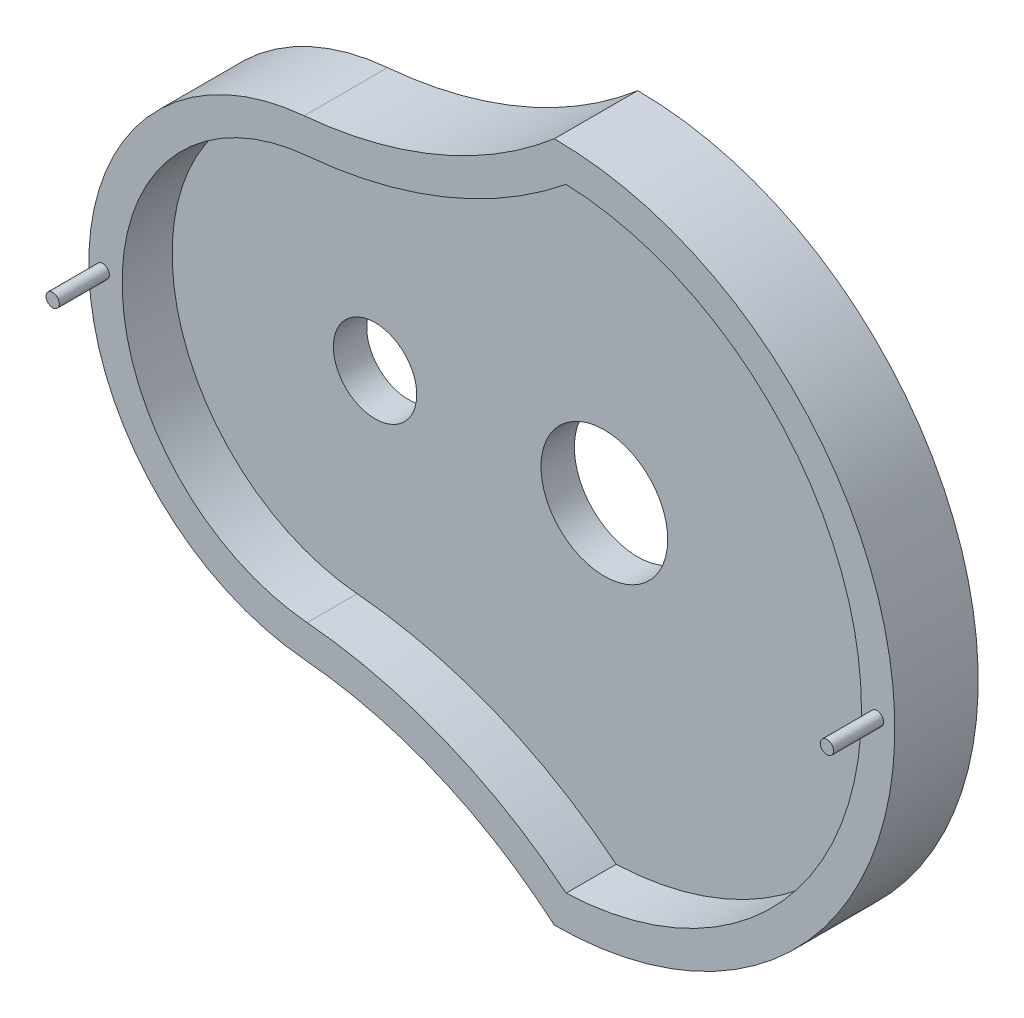
from build123d import *

# Parameters (mm, degrees)
BOSS_EXTRUDE1_DEPTH = 6.35
SHELL1_T            = -2.54
SKETCH2_R           = 0.508
BOSS_EXTRUDE2_DEPTH = 3.81
SKETCH3_R           = 4.826
SKETCH3_R_2         = 3.175
CUT_EXTRUDE1_DEPTH  = 2.54


with BuildPart() as part:
    # Sketch1 → Boss-Extrude1 (new body)
    with BuildSketch(Plane.XY):
        with BuildLine():
            ThreePointArc((0, -25.92959), (25.92959, 0), (0, 25.92959))
            ThreePointArc((0, 25.92959), (-8.900253562, 20.439501874), (-19.05, 17.921918042))
            ThreePointArc((-19.05, 17.921918042), (-35.45459, 0), (-19.05, -17.921918042))
            ThreePointArc((-19.05, -17.921918042), (-8.900253562, -20.439501874), (0, -25.92959))
        make_face()
    extrude(amount=BOSS_EXTRUDE1_DEPTH)

    # Shell1
    shell1_openings = [part.faces().sort_by_distance(p)[0] for p in [
        (-3.11409352, 0, 6.35),
    ]]
    offset(amount=SHELL1_T, openings=shell1_openings, kind=Kind.INTERSECTION)

    # Sketch2 → Boss-Extrude2 (add)
    with BuildSketch(Plane.XY.offset(6.35)):
        with Locations((-34.39268404, 0)):
            Circle(SKETCH2_R)
        with Locations((24.569143143, 0)):
            Circle(SKETCH2_R)
    extrude(amount=BOSS_EXTRUDE2_DEPTH)

    # Sketch3 → Cut-Extrude1 (cut)
    with BuildSketch(Plane.XY.offset(2.54)):
        Circle(SKETCH3_R)
        with Locations((-17.4625, 0)):
            Circle(SKETCH3_R_2)
    extrude(amount=-CUT_EXTRUDE1_DEPTH, mode=Mode.SUBTRACT)


solid = part.part
